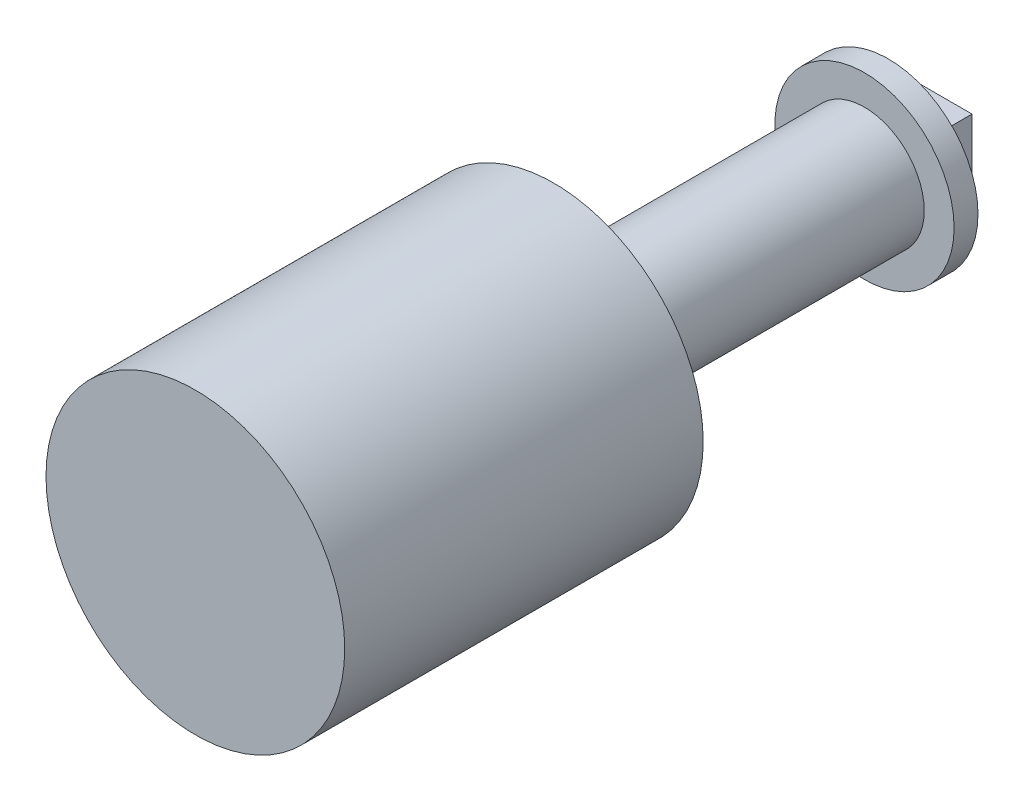
from build123d import *

# Parameters (mm, degrees)
SKETCH_1_R          = 12.5
EXTRUDE_1_DEPTH     = 30
SKETCH_4_R          = 1.5
CUT_EXTRUDE_1_DEPTH = 0.5
SKETCH_3_W          = 6
SKETCH_3_H          = 6
EXTRUDE_2_DEPTH     = 4


with BuildPart() as part:
    # 草图1 → 凸台-拉伸1 (new body)
    with BuildSketch(Plane.XY):
        Circle(SKETCH_1_R)
    extrude(amount=EXTRUDE_1_DEPTH)

    # 草图4 → 切除-拉伸1 (cut)
    with BuildSketch(Plane(origin=(0, 0, 0), x_dir=(-1, 0, 0), z_dir=(0, 0, -1))):
        with Locations((-8.5, 0)):
            Circle(SKETCH_4_R)
        with Locations(Location((8.5, 0, 0), (0, 0, 180))):
            Circle(SKETCH_4_R)
    extrude(amount=-CUT_EXTRUDE_1_DEPTH, mode=Mode.SUBTRACT)

    # 草图2 → 旋转2 (revolve)
    with BuildSketch(Plane(origin=(0, 0, 0), x_dir=(1, 0, 0), z_dir=(0, 1, 0))):
        Polygon((5, 28), (0, 28), (0, 0), (0.75, 0), (0.75, 5), (5, 5), (5, 26), (7.5, 26), (7.5, 28), align=None)
    revolve(axis=Axis((0, 0, 1000), (0, 0, -1)))

    # 草图3 → 凸台-拉伸2 (add)
    with BuildSketch(Plane(origin=(0, 0, -28), x_dir=(-1, 0, 0), z_dir=(0, 0, -1))):
        Rectangle(SKETCH_3_W, SKETCH_3_H)
    extrude(amount=EXTRUDE_2_DEPTH)


solid = part.part
